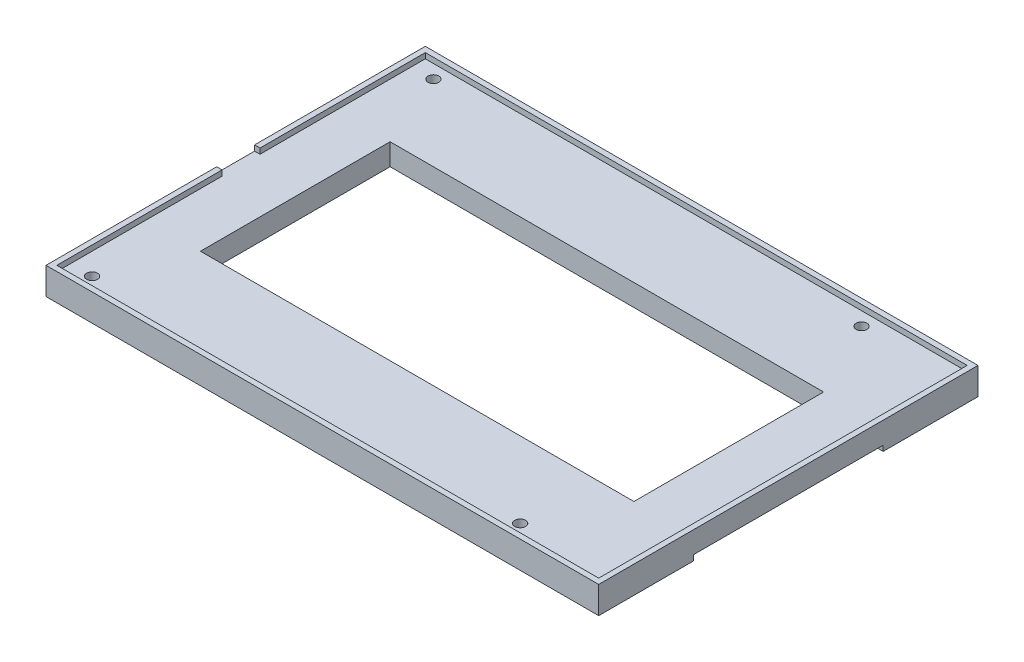
from build123d import *

# Parameters (mm, degrees)
SKETCH_1_W          = 102
SKETCH_1_H          = 70
EXTRUDE_1_DEPTH     = 5
SKETCH_2_R          = 1
CUT_EXTRUDE_1_DEPTH = 4.5
SKETCH_3_W          = 7
SKETCH_3_H          = 1
CUT_EXTRUDE_2_DEPTH = 2
SKETCH_4_W          = 80
SKETCH_4_H          = 35
CUT_EXTRUDE_3_DEPTH = 5
SKETCH_5_W          = 11
SKETCH_5_H          = 35
CUT_EXTRUDE_4_DEPTH = 1
SKETCH_6_W          = 100
SKETCH_6_H          = 68
CUT_EXTRUDE_5_DEPTH = 1


with BuildPart() as part:
    # Эскиз1 → Бобышка-Вытянуть1 (new body)
    with BuildSketch(Plane(origin=(0, 0, 0), x_dir=(1, 0, 0), z_dir=(0, 1, 0))):
        Rectangle(SKETCH_1_W, SKETCH_1_H)
    extrude(amount=EXTRUDE_1_DEPTH)

    # Эскиз2 → Вырез-Вытянуть1 (cut)
    with BuildSketch(Plane(origin=(0, 5, 0), x_dir=(1, 0, 0), z_dir=(0, 1, 0))):
        with Locations(Location((-46, 31.5, 0), (0, 0, 270))):
            Circle(SKETCH_2_R)
        with Locations(Location((33, 31.5, 0), (0, 0, 90))):
            Circle(SKETCH_2_R)
        with Locations(Location((33, -31.5, 0), (0, 0, 270))):
            Circle(SKETCH_2_R)
        with Locations(Location((-46, -31.5, 0), (0, 0, 90))):
            Circle(SKETCH_2_R)
    extrude(amount=-CUT_EXTRUDE_1_DEPTH, mode=Mode.SUBTRACT)

    # Эскиз3 → Вырез-Вытянуть2 (cut)
    with BuildSketch(Plane.ZY.offset(51)):
        with Locations((0, 4.5)):
            Rectangle(SKETCH_3_W, SKETCH_3_H)
    extrude(amount=-CUT_EXTRUDE_2_DEPTH, mode=Mode.SUBTRACT)

    # Эскиз4 → Вырез-Вытянуть3 (cut)
    with BuildSketch(Plane.XZ):
        Rectangle(SKETCH_4_W, SKETCH_4_H)
    extrude(amount=-CUT_EXTRUDE_3_DEPTH, mode=Mode.SUBTRACT)

    # Эскиз5 → Вырез-Вытянуть4 (cut)
    with BuildSketch(Plane.XZ):
        with Locations((45.5, 0)):
            Rectangle(SKETCH_5_W, SKETCH_5_H)
    extrude(amount=-CUT_EXTRUDE_4_DEPTH, mode=Mode.SUBTRACT)

    # Эскиз6 → Вырез-Вытянуть5 (cut)
    with BuildSketch(Plane(origin=(0, 5, 0), x_dir=(1, 0, 0), z_dir=(0, 1, 0))):
        Rectangle(SKETCH_6_W, SKETCH_6_H)
    extrude(amount=-CUT_EXTRUDE_5_DEPTH, mode=Mode.SUBTRACT)


solid = part.part
